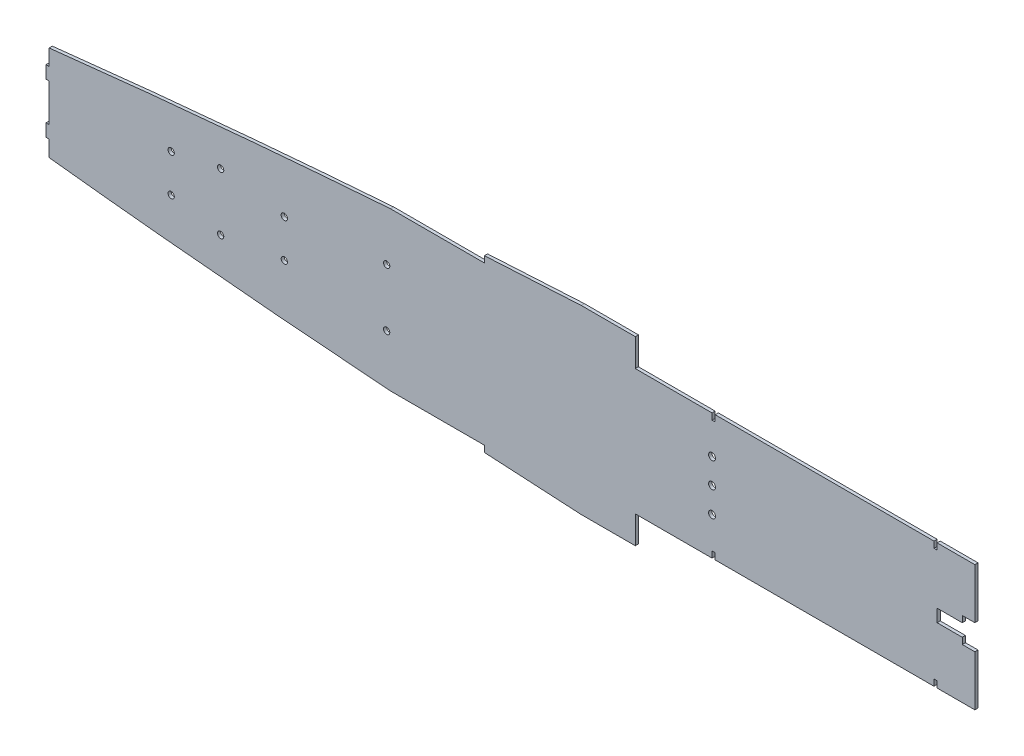
from build123d import *

# Parameters (mm, degrees)
BOSS_EXTRUDE1_DEPTH    = 1.5875
SKETCH10_W             = 6.35
SKETCH10_H             = 68.58
CUT_EXTRUDE5_DEPTH     = 637.645771754
CUT_EXTRUDE1_DEPTH     = 631.312352085
SKETCH4_W              = 1.5875
SKETCH4_H              = 3.175
CUT_EXTRUDE2_DEPTH     = 631.312352085
SKETCH6_W              = 47.338109293
SKETCH6_H              = 3.175
CUT_EXTRUDE3_DEPTH     = 631.312352085
SKETCH7_R              = 1.5875
ARTS4_MOUNT_DEPTH      = 631.312352085
SKETCH8_R              = 1.5875
TELEMETRUM_MOUNT_DEPTH = 631.312352085
SKETCH9_R              = 1.74625
CUT_EXTRUDE4_DEPTH     = 631.312352085


with BuildPart() as part:
    # Sketch1 → Boss-Extrude1 (new body)
    with BuildSketch(Plane.XY):
        with BuildLine():
            Line((508, -45.72), (508, -34.29))
            Line((508, -34.29), (635, -34.29))
            Line((635, -34.29), (635, 34.29))
            Line((635, 34.29), (508, 34.29))
            Line((508, 34.29), (508, 45.72))
            Line((508, 45.72), (429.947642932, 45.72))
            add(Edge.make_bspline(
                [(161.29, 23.981640211), (161.616784041, 24.018741883), (172.383373415, 25.239568053), (204.048179593, 28.679227521), (256.348102033, 33.727983978), (319.188209115, 38.915614913), (371.60802888, 42.52482202), (408.536828327, 44.644949518), (424.488578703, 45.455997775), (429.947642932, 45.72)],
                knots=[0.31962734, 0.31962734, 0.31962734, 0.31962734, 0.321557959, 0.383234508, 0.506587607, 0.629940705, 0.753293803, 0.814970352, 0.847054623, 0.847054623, 0.847054623, 0.847054623], degree=3))
            Line((161.29, 23.981640211), (161.29, 15.875))
            Line((161.29, 15.875), (159.7025, 15.875))
            Line((159.7025, 15.875), (159.7025, 9.525))
            Line((159.7025, 9.525), (161.29, 9.525))
            Line((161.29, 9.525), (161.29, -9.525))
            Line((161.29, -9.525), (159.7025, -9.525))
            Line((159.7025, -9.525), (159.7025, -15.875))
            Line((159.7025, -15.875), (161.29, -15.875))
            Line((161.29, -15.875), (161.29, -23.981640211))
            add(Edge.make_bspline(
                [(429.947642932, -45.72), (424.488578703, -45.455997775), (408.536828327, -44.644949518), (371.60802888, -42.52482202), (319.188209115, -38.915614913), (256.348102033, -33.727983978), (204.048179593, -28.679227521), (172.383373415, -25.239568053), (161.616784041, -24.018741883), (161.29, -23.981640211)],
                knots=[0.16612059, 0.16612059, 0.16612059, 0.16612059, 0.198204861, 0.25988141, 0.383234508, 0.506587607, 0.629940705, 0.691617254, 0.693547873, 0.693547873, 0.693547873, 0.693547873], degree=3))
            Line((429.947642932, -45.72), (508, -45.72))
        make_face()
    extrude(amount=BOSS_EXTRUDE1_DEPTH)

    # Sketch10 → Cut-Extrude5 (cut, through all)
    with BuildSketch(Plane(origin=(0, 0, 0), x_dir=(-1, 0, 0), z_dir=(0, 0, -1))):
        with Locations((-631.825, 0)):
            Rectangle(SKETCH10_W, SKETCH10_H)
    extrude(amount=-CUT_EXTRUDE5_DEPTH, mode=Mode.SUBTRACT)

    # Sketch3 → Cut-Extrude1 (cut, through all)
    with BuildSketch(Plane.XY.offset(1.5875)):
        Polygon((635, 34.29), (508, 34.29), (508, 45.72), (457.2, 45.72), (457.2, 31.75), (635, 31.75), align=None)
        Polygon((508, -45.72), (508, -34.29), (635, -34.29), (635, -31.75), (457.2, -31.75), (457.2, -45.72), align=None)
        Polygon((622.3, 6.35), (622.3, 3.175), (609.6, 3.175), (609.6, -3.175), (622.3, -3.175), (622.3, -6.35), (628.65, -6.35), (628.65, 6.35), align=None)
    extrude(amount=-CUT_EXTRUDE1_DEPTH, mode=Mode.SUBTRACT)

    # Sketch4 → Cut-Extrude2 (cut, through all)
    with BuildSketch(Plane.XY.offset(1.5875)):
        with Locations((496.7605, 30.1625)):
            Rectangle(SKETCH4_W, SKETCH4_H)
        with Locations((608.80625, 30.1625)):
            Rectangle(SKETCH4_W, SKETCH4_H)
        with Locations((496.7605, -30.1625)):
            Rectangle(SKETCH4_W, SKETCH4_H)
        with Locations((608.80625, -30.1625)):
            Rectangle(SKETCH4_W, SKETCH4_H)
    extrude(amount=-CUT_EXTRUDE2_DEPTH, mode=Mode.SUBTRACT)

    # Sketch6 → Cut-Extrude3 (cut, through all)
    with BuildSketch(Plane.XY.offset(1.5875)):
        with Locations((357.330945353, 41.432202354)):
            Rectangle(SKETCH6_W, SKETCH6_H)
        with Locations((357.330945353, -41.432202354)):
            Rectangle(SKETCH6_W, SKETCH6_H)
    extrude(amount=-CUT_EXTRUDE3_DEPTH, mode=Mode.SUBTRACT)

    # Sketch7 → ARTS4 mount (cut, through all)
    with BuildSketch(Plane.XY.offset(1.5875)):
        with Locations((331.688780886, 14.478)):
            Circle(SKETCH7_R)
        with Locations((331.688780886, -14.478)):
            Circle(SKETCH7_R)
        with Locations((247.868780886, 14.478)):
            Circle(SKETCH7_R)
        with Locations((247.868780886, -14.478)):
            Circle(SKETCH7_R)
    extrude(amount=-ARTS4_MOUNT_DEPTH, mode=Mode.SUBTRACT)

    # Sketch8 → Telemetrum Mount (cut, through all)
    with BuildSketch(Plane.XY.offset(1.5875)):
        with Locations((280.018433255, 9.525)):
            Circle(SKETCH8_R)
        with Locations((280.018433255, -9.525)):
            Circle(SKETCH8_R)
        with Locations((222.893833255, -9.525)):
            Circle(SKETCH8_R)
        with Locations((222.893833255, 9.525)):
            Circle(SKETCH8_R)
    extrude(amount=-TELEMETRUM_MOUNT_DEPTH, mode=Mode.SUBTRACT)

    # Sketch9 → Cut-Extrude4 (cut, through all)
    with BuildSketch(Plane.XY.offset(1.5875)):
        with Locations((495.96675, -12.7)):
            Circle(SKETCH9_R)
        with Locations((495.96675, 12.7)):
            Circle(SKETCH9_R)
        with Locations((495.96675, 0)):
            Circle(SKETCH9_R)
    extrude(amount=-CUT_EXTRUDE4_DEPTH, mode=Mode.SUBTRACT)


solid = part.part
